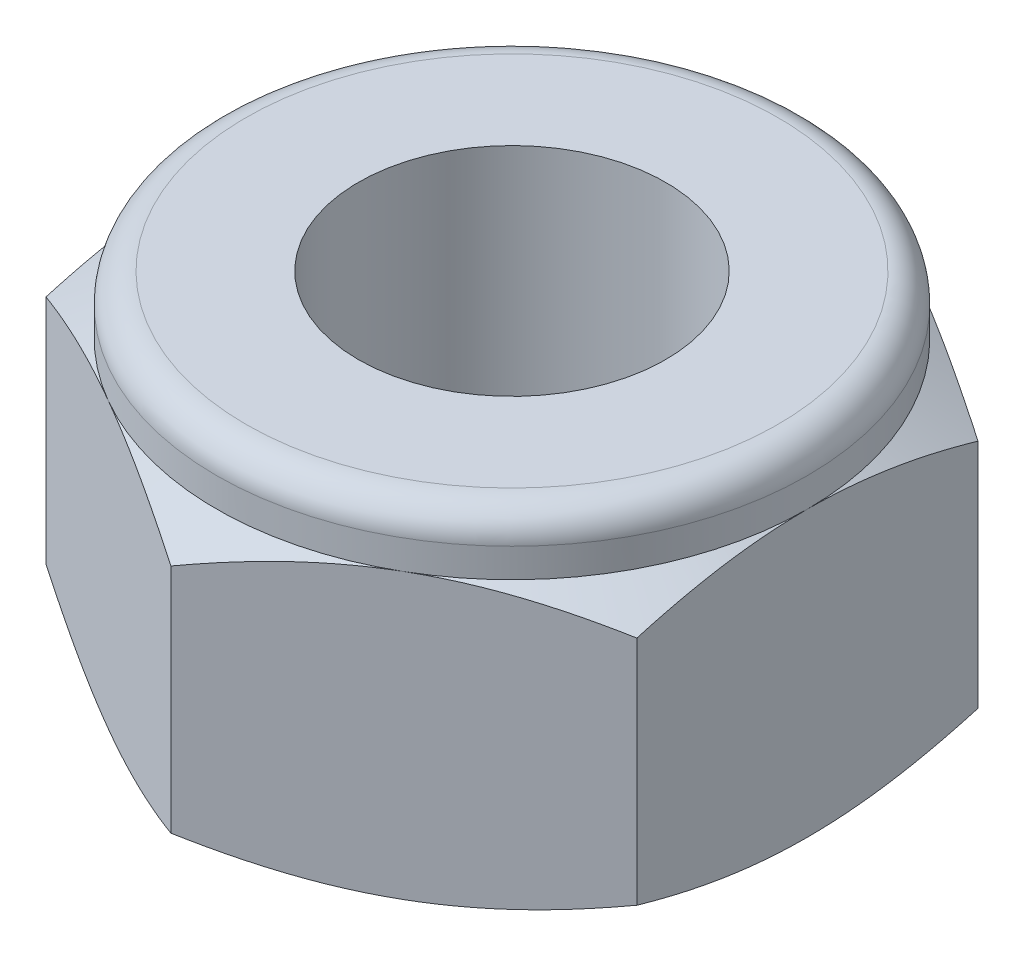
from build123d import *

# Parameters (mm, degrees)
SKETCH1_R      = 2.6
EXTRUDE1_DEPTH = 5.8
SKETCH2_W      = 2
SKETCH2_H      = 1
FILLET1_R      = 0.5


with BuildPart() as part:
    # Sketch1 → Extrude1 (new body)
    with BuildSketch(Plane(origin=(0, 0, 0), x_dir=(1, 0, 0), z_dir=(0, 1, 0))):
        Polygon((0, -5.773502692), (5, -2.886751346), (5, 2.886751346), (0, 5.773502692), (-5, 2.886751346), (-5, -2.886751346), align=None)
        with Locations(Location((0, 0, 0), (0, 0, 270))):
            Circle(SKETCH1_R, mode=Mode.SUBTRACT)
    extrude(amount=EXTRUDE1_DEPTH)

    # Sketch2 → Cut-Revolve1 (revolve, cut)
    with BuildSketch(Plane.XY, mode=Mode.PRIVATE) as cut_revolve1_sk:
        Polygon((-5, 5.8), (-5, 4.809401077), (-9, 2.5), (-9, 5.8), align=None)
        with Locations((-1, 5.3)):
            Rectangle(SKETCH2_W, SKETCH2_H)
        Polygon((-5, 0), (-9, 0), (-9, 2.309401077), align=None)
    revolve(cut_revolve1_sk.sketch.rotate(Axis((0, 0, 0), (0, 1, 0)), 180), axis=Axis((0, 0, 0), (0, 1, 0)), mode=Mode.SUBTRACT)

    # Fillet1
    fillet1_edges = [part.edges().sort_by_distance(p)[0] for p in [
        (-5, 5.8, 0),
    ]]
    fillet(fillet1_edges, radius=FILLET1_R)


solid = part.part
